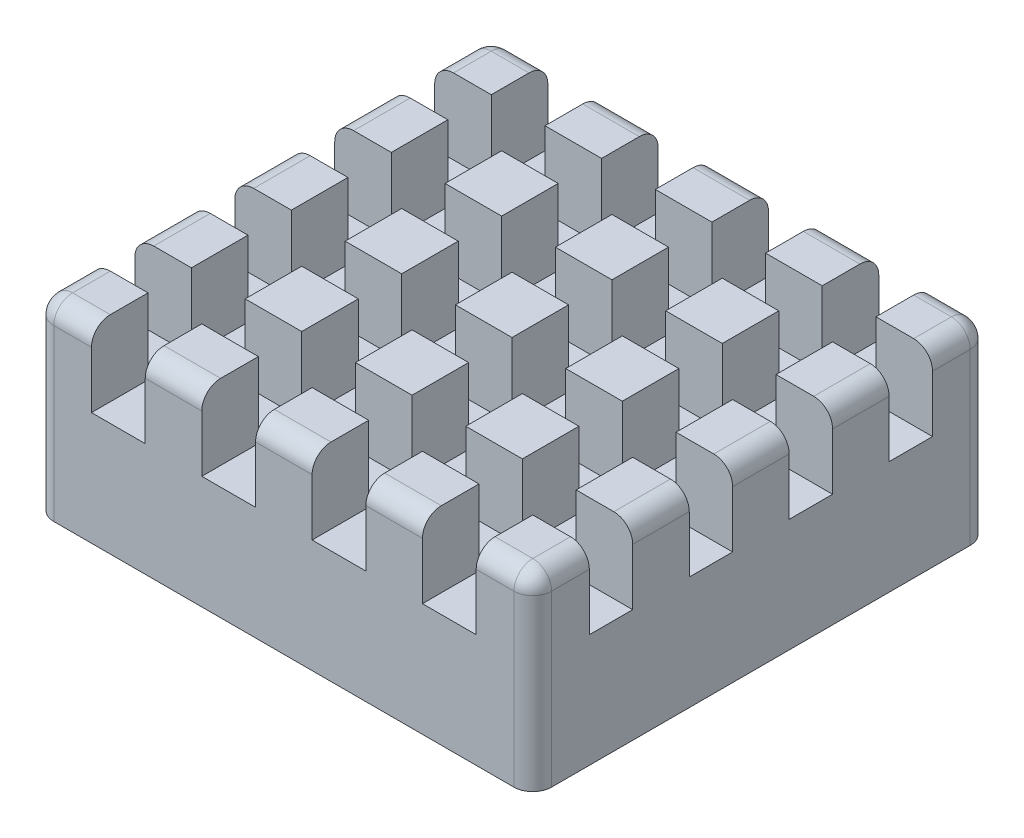
from build123d import *

# Parameters (mm, degrees)
SKETCH1_W           = 13.2
SKETCH1_H           = 12.1
BOSS_EXTRUDE1_DEPTH = 3
SKETCH2_W           = 1.5
SKETCH2_H           = 1.5
BOSS_EXTRUDE2_DEPTH = 2
FILLET1_R           = 0.5


with BuildPart() as part:
    # Sketch1 → Boss-Extrude1 (new body)
    with BuildSketch(Plane(origin=(0, 0, 0), x_dir=(1, 0, 0), z_dir=(0, 1, 0))):
        with Locations((6.6, 6.05)):
            Rectangle(SKETCH1_W, SKETCH1_H)
    extrude(amount=-BOSS_EXTRUDE1_DEPTH)

    # Sketch2 → Boss-Extrude2 (add)
    with BuildSketch(Plane(origin=(0, 0, 0), x_dir=(1, 0, 0), z_dir=(0, 1, 0))):
        with Locations((3.675, 11.35)):
            Rectangle(SKETCH2_W, SKETCH2_H)
        with Locations((0.75, 11.35)):
            Rectangle(SKETCH2_W, SKETCH2_H)
        with Locations((6.6, 11.35)):
            Rectangle(SKETCH2_W, SKETCH2_H)
        with Locations((9.525, 11.35)):
            Rectangle(SKETCH2_W, SKETCH2_H)
        with Locations((12.45, 11.35)):
            Rectangle(SKETCH2_W, SKETCH2_H)
        with Locations((3.675, 8.7)):
            Rectangle(SKETCH2_W, SKETCH2_H)
        with Locations((6.6, 8.7)):
            Rectangle(SKETCH2_W, SKETCH2_H)
        with Locations((9.525, 8.7)):
            Rectangle(SKETCH2_W, SKETCH2_H)
        with Locations((12.45, 8.7)):
            Rectangle(SKETCH2_W, SKETCH2_H)
        with Locations((3.675, 6.05)):
            Rectangle(SKETCH2_W, SKETCH2_H)
        with Locations((6.6, 6.05)):
            Rectangle(SKETCH2_W, SKETCH2_H)
        with Locations((9.525, 6.05)):
            Rectangle(SKETCH2_W, SKETCH2_H)
        with Locations((12.45, 6.05)):
            Rectangle(SKETCH2_W, SKETCH2_H)
        with Locations((3.675, 3.4)):
            Rectangle(SKETCH2_W, SKETCH2_H)
        with Locations((6.6, 3.4)):
            Rectangle(SKETCH2_W, SKETCH2_H)
        with Locations((9.525, 3.4)):
            Rectangle(SKETCH2_W, SKETCH2_H)
        with Locations((12.45, 3.4)):
            Rectangle(SKETCH2_W, SKETCH2_H)
        with Locations((3.675, 0.75)):
            Rectangle(SKETCH2_W, SKETCH2_H)
        with Locations((6.6, 0.75)):
            Rectangle(SKETCH2_W, SKETCH2_H)
        with Locations((9.525, 0.75)):
            Rectangle(SKETCH2_W, SKETCH2_H)
        with Locations((12.45, 0.75)):
            Rectangle(SKETCH2_W, SKETCH2_H)
        with Locations((0.75, 8.7)):
            Rectangle(SKETCH2_W, SKETCH2_H)
        with Locations((0.75, 6.05)):
            Rectangle(SKETCH2_W, SKETCH2_H)
        with Locations((0.75, 3.4)):
            Rectangle(SKETCH2_W, SKETCH2_H)
        with Locations((0.75, 0.75)):
            Rectangle(SKETCH2_W, SKETCH2_H)
    extrude(amount=BOSS_EXTRUDE2_DEPTH)

    # Fillet1
    fillet1_edges = [part.edges().sort_by_distance(p)[0] for p in [
        (13.2, 2, -8.7),
        (13.2, 2, -6.05),
        (0, 2, -11.35),
        (0.75, 2, -12.1),
        (13.2, 2, -3.4),
        (3.675, 2, 0),
        (6.6, 2, 0),
        (9.525, 2, 0),
        (12.45, 2, 0),
        (13.2, 2, -0.75),
        (0, 2, -8.7),
        (0, 2, -6.05),
        (0, 2, -3.4),
        (0, 2, -0.75),
        (0.75, 2, 0),
        (3.675, 2, -12.1),
        (6.6, 2, -12.1),
        (9.525, 2, -12.1),
        (12.45, 2, -12.1),
        (13.2, 2, -11.35),
        (0, -0.5, -12.1),
        (13.2, -0.5, -12.1),
        (13.2, -0.5, 0),
        (0, -0.5, 0),
    ]]
    fillet(fillet1_edges, radius=FILLET1_R)


solid = part.part
